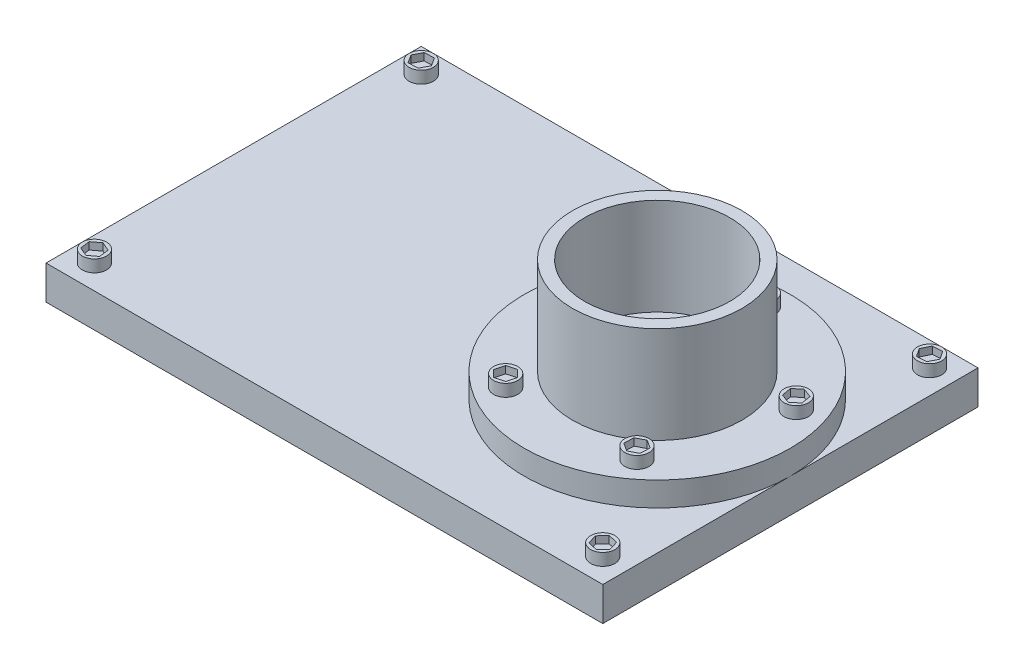
from build123d import *

# Parameters (mm, degrees)
SKETCH1_W           = 230
SKETCH1_H           = 155
BOSS_EXTRUDE1_DEPTH = 14
SKETCH2_R           = 55
BOSS_EXTRUDE2_DEPTH = 10
SKETCH4_R           = 35
BOSS_EXTRUDE3_DEPTH = 40
SKETCH8_R           = 30
CUT_EXTRUDE1_DEPTH  = 40
SKETCH11_R          = 5
BOSS_EXTRUDE5_DEPTH = 5
CUT_EXTRUDE3_DEPTH  = 3
SKETCH14_R          = 5
BOSS_EXTRUDE8_DEPTH = 5
CUT_EXTRUDE4_DEPTH  = 3


with BuildPart() as part:
    # Sketch1 → Boss-Extrude1 (new body)
    with BuildSketch(Plane(origin=(0, 0, 0), x_dir=(1, 0, 0), z_dir=(0, 1, 0))):
        with Locations((115, 77.5)):
            Rectangle(SKETCH1_W, SKETCH1_H)
    extrude(amount=BOSS_EXTRUDE1_DEPTH)

    # Sketch2 → Boss-Extrude2 (add)
    with BuildSketch(Plane(origin=(0, 14, 0), x_dir=(1, 0, 0), z_dir=(0, 1, 0))):
        with Locations((175, 77.5)):
            Circle(SKETCH2_R)
    extrude(amount=BOSS_EXTRUDE2_DEPTH)

    # Sketch4 → Boss-Extrude3 (add)
    with BuildSketch(Plane(origin=(0, 24, 0), x_dir=(1, 0, 0), z_dir=(0, 1, 0))):
        with Locations(Location((175, 77.5, 0), (0, 0, 270))):
            Circle(SKETCH4_R)
    extrude(amount=BOSS_EXTRUDE3_DEPTH)

    # Sketch8 → Cut-Extrude1 (cut)
    with BuildSketch(Plane(origin=(0, 64, 0), x_dir=(1, 0, 0), z_dir=(0, 1, 0))):
        with Locations(Location((175, 77.5, 0), (0, 0, 270))):
            Circle(SKETCH8_R)
    extrude(amount=-CUT_EXTRUDE1_DEPTH, mode=Mode.SUBTRACT)

    # Sketch11 → Boss-Extrude5 (add)
    with BuildSketch(Plane(origin=(0, 14, 0), x_dir=(1, 0, 0), z_dir=(0, 1, 0))):
        with Locations(Location((10, 10, 0), (0, 0, 90))):
            Circle(SKETCH11_R)
        with Locations(Location((10, 145, 0), (0, 0, 90))):
            Circle(SKETCH11_R)
        with Locations(Location((220, 145, 0), (0, 0, 90))):
            Circle(SKETCH11_R)
        with Locations(Location((220, 10, 0), (0, 0, 90))):
            Circle(SKETCH11_R)
    extrude(amount=BOSS_EXTRUDE5_DEPTH)

    # Sketch13 → Cut-Extrude3 (cut)
    with BuildSketch(Plane(origin=(0, 19, 0), x_dir=(1, 0, 0), z_dir=(0, 1, 0))):
        Polygon((13.224457924, 12.436432727), (9.502216326, 14.010678839), (6.277758402, 11.574246112), (6.775542076, 7.563567273), (10.497783674, 5.989321161), (13.722241598, 8.425753888), align=None)
        Polygon((11.87304845, 148.581204105), (7.835110494, 148.412709592), (5.962062044, 144.831505488), (8.12695155, 141.418795895), (12.164889506, 141.587290408), (14.037937956, 145.168494512), align=None)
        Polygon((224.033447208, 145.254237993), (221.796547043, 148.620186743), (217.763099836, 148.36594875), (215.966552792, 144.745762007), (218.203452957, 141.379813257), (222.236900164, 141.63405125), align=None)
        Polygon((222.73323395, 12.977039723), (218.788424947, 13.855569896), (216.055190997, 10.878530173), (217.26676605, 7.022960277), (221.211575053, 6.144430104), (223.944809003, 9.121469827), align=None)
    extrude(amount=-CUT_EXTRUDE3_DEPTH, mode=Mode.SUBTRACT)

    # Sketch14 → Boss-Extrude8 (add)
    with BuildSketch(Plane(origin=(0, 24, 0), x_dir=(1, 0, 0), z_dir=(0, 1, 0))):
        with Locations(Location((173.870837224, 122.5, 0), (0, 0, 270))):
            Circle(SKETCH14_R)
        with Locations(Location((217.448612746, 92.479662363, 0), (0, 0, 270))):
            Circle(SKETCH14_R)
        with Locations(Location((202.363848229, 41.75794048, 0), (0, 0, 270))):
            Circle(SKETCH14_R)
        with Locations(Location((149.463175522, 40.430530026, 0), (0, 0, 270))):
            Circle(SKETCH14_R)
        with Locations(Location((131.853526279, 90.331867131, 0), (0, 0, 270))):
            Circle(SKETCH14_R)
    extrude(amount=BOSS_EXTRUDE8_DEPTH)

    # Sketch15 → Cut-Extrude4 (cut)
    with BuildSketch(Plane(origin=(0, 29, 0), x_dir=(1, 0, 0), z_dir=(0, 1, 0))):
        Polygon((221.229030496, 91.050755448), (220.576291309, 95.039146714), (216.795873559, 96.468053629), (213.668194996, 93.908569278), (214.320934183, 89.920178012), (218.101351933, 88.491271098), align=None)
        Polygon((176.398021787, 125.653834415), (172.403128782, 126.265523239), (169.875944219, 123.111688824), (171.343652661, 119.346165585), (175.338545665, 118.734476761), (177.865730228, 121.888311176), align=None)
        Polygon((202.173090327, 37.720993025), (205.764568327, 39.574265564), (205.955326229, 43.611213019), (202.554606131, 45.794887936), (198.96312813, 43.941615397), (198.772370228, 39.904667942), align=None)
        Polygon((145.564862905, 39.364466202), (148.437257567, 36.521460356), (152.335570184, 37.587524179), (153.361488139, 41.496593849), (150.489093478, 44.339599695), (146.590780861, 43.273535872), align=None)
        Polygon((129.634994486, 93.709950909), (127.818754014, 90.099604127), (130.037285808, 86.721520349), (134.072058073, 86.953783352), (135.888298544, 90.564130134), (133.669766751, 93.942213912), align=None)
    extrude(amount=-CUT_EXTRUDE4_DEPTH, mode=Mode.SUBTRACT)


solid = part.part
